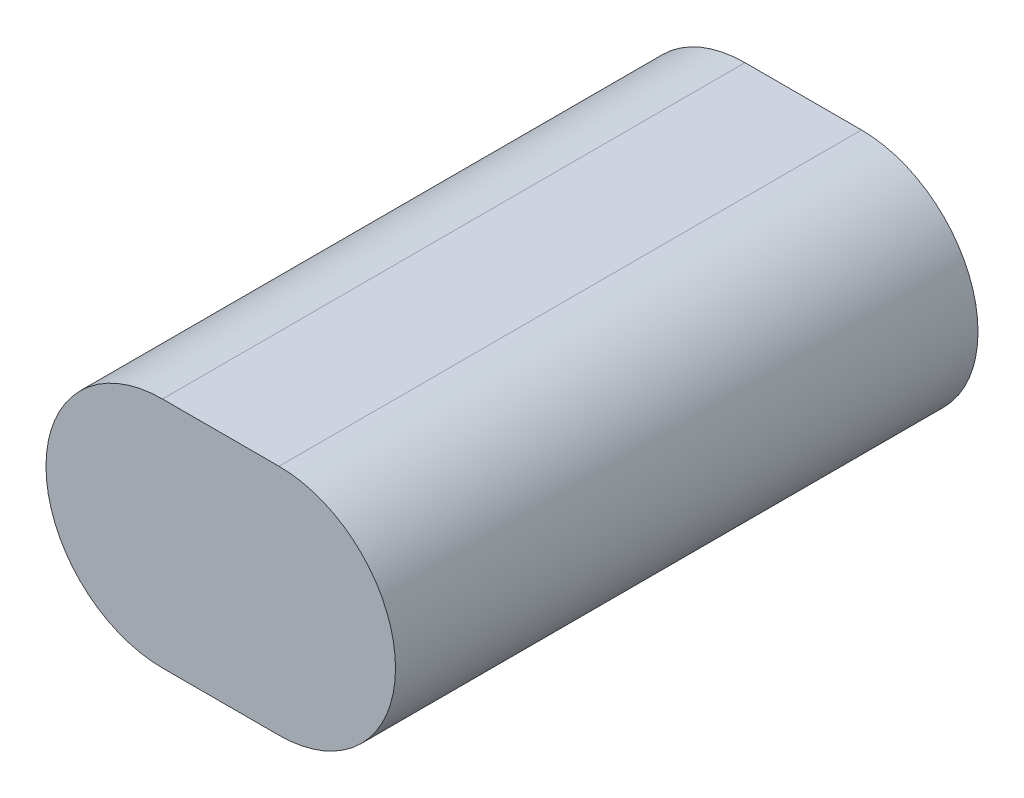
from build123d import *

# Parameters (mm, degrees)
BOSS_EXTRUDE1_DEPTH = 100


with BuildPart() as part:
    # Sketch1 → Boss-Extrude1 (new body)
    with BuildSketch(Plane.XY):
        with BuildLine():
            Line((0, 20), (20, 20))
            ThreePointArc((20, 20), (40, 0), (20, -20))
            Line((20, -20), (0, -20))
            ThreePointArc((0, -20), (-20, 0), (0, 20))
        make_face()
    extrude(amount=BOSS_EXTRUDE1_DEPTH)


solid = part.part
